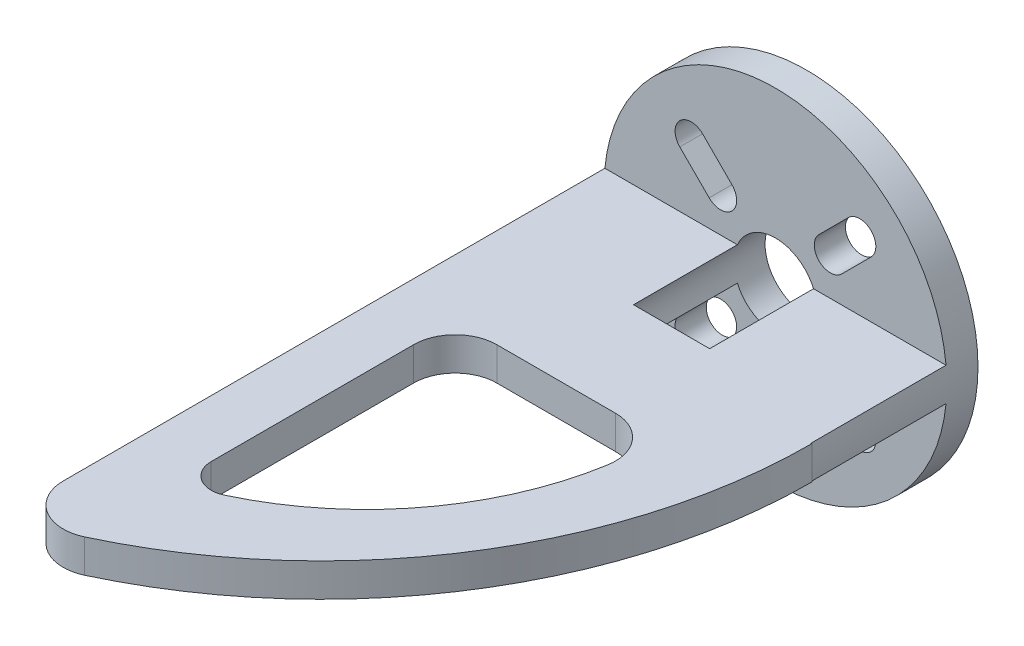
from build123d import *
from build123d.topology import SkipClean

# Parameters (mm, degrees)
SKETCH_1_R       = 16.5
SKETCH_1_R_2     = 4
EXTRUDE_4_DEPTH  = 3
EXTRUDE_6_DEPTH  = 10
EXTRUDE_12_DEPTH = 3
EXTRUDE_14_DEPTH = 3.2


with BuildPart() as part:
    # 草图1 → 凸台-拉伸4 (new body)
    with BuildSketch(Plane.XY):
        with Locations((0, 3e-09)):
            Circle(SKETCH_1_R)
        with Locations((0, 3e-09)):
            Circle(SKETCH_1_R_2, mode=Mode.SUBTRACT)
        with BuildLine():
            Line((-7.017492281, 9.175302033), (-4.189065156, 6.346874908))
            ThreePointArc((-4.189065156, 6.346874908), (-4.189065156, 4.154843887), (-6.381096178, 4.154843887))
            Line((-6.381096178, 4.154843887), (-9.209523303, 6.983271012))
            ThreePointArc((-9.209523303, 6.983271012), (-9.209523303, 9.175302033), (-7.017492281, 9.175302033))
        make_face(mode=Mode.SUBTRACT)
        with BuildLine():
            Line((7.017492281, 9.209523305), (4.189065156, 6.381096181))
            ThreePointArc((4.189065156, 6.381096181), (4.189065156, 4.189065159), (6.381096178, 4.189065159))
            Line((6.381096178, 4.189065159), (9.209523303, 7.017492284))
            ThreePointArc((9.209523303, 7.017492284), (9.209523303, 9.209523305), (7.017492281, 9.209523305))
        make_face(mode=Mode.SUBTRACT)
        with BuildLine():
            Line((-7.017492281, -9.2095233), (-4.189065156, -6.381096175))
            ThreePointArc((-4.189065156, -6.381096175), (-4.189065156, -4.189065153), (-6.381096178, -4.189065153))
            Line((-6.381096178, -4.189065153), (-9.209523303, -7.017492278))
            ThreePointArc((-9.209523303, -7.017492278), (-9.209523303, -9.2095233), (-7.017492281, -9.2095233))
        make_face(mode=Mode.SUBTRACT)
        with BuildLine():
            Line((7.017492281, -9.2095233), (4.189065156, -6.381096175))
            ThreePointArc((4.189065156, -6.381096175), (4.189065156, -4.189065153), (6.381096178, -4.189065153))
            Line((6.381096178, -4.189065153), (9.209523303, -7.017492278))
            ThreePointArc((9.209523303, -7.017492278), (9.209523303, -9.2095233), (7.017492281, -9.2095233))
        make_face(mode=Mode.SUBTRACT)
    extrude(amount=EXTRUDE_4_DEPTH)

    # 草图3 → 凸台-拉伸6 (add)
    with SkipClean():  # the faces are left unmerged after this step: merging them gives an invalid solid
        with BuildSketch(Plane.XY.offset(3)):
            with BuildLine():
                Line((16.422241017, 1.600000001), (3.666060557, 1.600000001))
                ThreePointArc((3.666060557, 1.600000001), (4, 0), (3.666060555, -1.6))
                Line((3.666060555, -1.6), (16.422241016, -1.6))
                ThreePointArc((16.422241016, -1.6), (16.5, 0), (16.422241017, 1.600000001))
            make_face()
            with BuildLine():
                Line((-16.422241017, 1.600000001), (-3.666060557, 1.600000001))
                ThreePointArc((-3.666060557, 1.600000001), (-4, 0), (-3.666060555, -1.6))
                Line((-3.666060555, -1.6), (-16.422241016, -1.6))
                ThreePointArc((-16.422241016, -1.6), (-16.5, 0), (-16.422241017, 1.600000001))
            make_face()
        extrude(amount=EXTRUDE_6_DEPTH)

    # 草图4 → 凸台-拉伸12 (add)
    with SkipClean():  # the faces are left unmerged after this step: merging them gives an invalid solid
        with BuildSketch(Plane.XY.offset(13)):
            with BuildLine():
                Line((-16.422241017, 1.600000001), (16.422241017, 1.600000001))
                ThreePointArc((16.422241017, 1.600000001), (16.5, 0), (16.422241016, -1.6))
                Line((16.422241016, -1.6), (-16.422241016, -1.6))
                ThreePointArc((-16.422241016, -1.6), (-16.5, 0), (-16.422241017, 1.600000001))
            make_face()
        extrude(amount=EXTRUDE_12_DEPTH)

    # 草图8 → 凸台-拉伸14 (add)
    with SkipClean():  # the faces are left unmerged after this step: merging them gives an invalid solid
        with BuildSketch(Plane(origin=(0, 1.600000001, 0), x_dir=(1, 0, 0), z_dir=(0, 1, 0))):
            with BuildLine():
                Line((-16.422241017, -16), (-16.422241017, -55.152668259))
                ThreePointArc((-16.422241017, -55.152668259), (-14.570166648, -58.527044569), (-10.729033275, -58.776622942))
                ThreePointArc((-10.729033275, -58.776622942), (9.115230867, -41.353795196), (16.5, -16))
                Line((16.5, -16), (-16.422241017, -16))
            make_face()
            with BuildLine():
                Line((-6.919334161, -22.910583914), (4.502935407, -22.910583914))
                ThreePointArc((4.502935407, -22.910583914), (7.555031335, -24.325103215), (8.448502964, -27.568228691))
                ThreePointArc((8.448502964, -27.568228691), (3.06689673, -40.042318745), (-7.503409516, -48.576557679))
                ThreePointArc((-7.503409516, -48.576557679), (-9.80808954, -48.426810655), (-10.919334161, -46.402184869))
                Line((-10.919334161, -46.402184869), (-10.919334161, -26.910583914))
                ThreePointArc((-10.919334161, -26.910583914), (-9.747761286, -24.082156789), (-6.919334161, -22.910583914))
            make_face(mode=Mode.SUBTRACT)
        extrude(amount=-EXTRUDE_14_DEPTH)


solid = part.part
